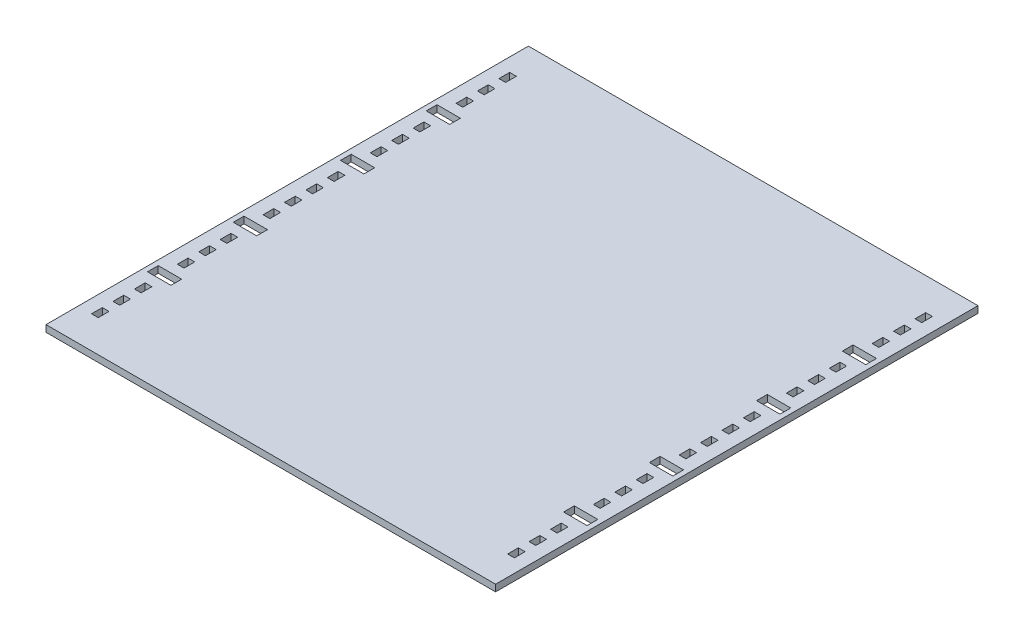
from build123d import *

# Parameters (mm, degrees)
SKETCH2_W           = 3.175
SKETCH2_H           = 5.08
SKETCH2_W_2         = 11.1125
BOSS_EXTRUDE1_DEPTH = 3.175


with BuildPart() as part:
    # Sketch2 → Boss-Extrude1 (new body)
    with BuildSketch(Plane(origin=(0, 0, 0), x_dir=(1, 0, 0), z_dir=(0, 1, 0))):
        Polygon((-61.882132175, -180.324220965), (151.160367825, -180.324220965), (151.160367825, -134.604220965), (151.160367825, -129.524220965), (151.160367825, -93.964220965), (151.160367825, -88.884220965), (151.160367825, -43.164220965), (151.160367825, -38.084220965), (151.160367825, -2.524220965), (151.160367825, 2.555779035), (151.160367825, 48.275779035), (-61.882132175, 48.275779035), (-61.882132175, 2.555779035), (-61.882132175, -2.524220965), (-61.882132175, -38.084220965), (-61.882132175, -43.164220965), (-61.882132175, -93.964220965), (-61.882132175, -129.524220965), (-61.882132175, -134.604220965), align=None)
        with Locations((-53.944632175, -162.544220965)):
            Rectangle(SKETCH2_W, SKETCH2_H, mode=Mode.SUBTRACT)
        with Locations((143.222867825, -162.544220965)):
            Rectangle(SKETCH2_W, SKETCH2_H, mode=Mode.SUBTRACT)
        with Locations((-53.944632175, -152.384220965)):
            Rectangle(SKETCH2_W, SKETCH2_H, mode=Mode.SUBTRACT)
        with Locations((-53.944632175, -142.224220965)):
            Rectangle(SKETCH2_W, SKETCH2_H, mode=Mode.SUBTRACT)
        with Locations((-53.944632175, -121.904220965)):
            Rectangle(SKETCH2_W, SKETCH2_H, mode=Mode.SUBTRACT)
        with Locations((-53.944632175, -111.744220965)):
            Rectangle(SKETCH2_W, SKETCH2_H, mode=Mode.SUBTRACT)
        with Locations((-53.944632175, -101.584220965)):
            Rectangle(SKETCH2_W, SKETCH2_H, mode=Mode.SUBTRACT)
        with Locations((-53.944632175, -81.264220965)):
            Rectangle(SKETCH2_W, SKETCH2_H, mode=Mode.SUBTRACT)
        with Locations((-53.944632175, -71.104220965)):
            Rectangle(SKETCH2_W, SKETCH2_H, mode=Mode.SUBTRACT)
        with Locations((-53.944632175, -60.944220965)):
            Rectangle(SKETCH2_W, SKETCH2_H, mode=Mode.SUBTRACT)
        with Locations((-53.944632175, -50.784220965)):
            Rectangle(SKETCH2_W, SKETCH2_H, mode=Mode.SUBTRACT)
        with Locations((-53.944632175, -30.464220965)):
            Rectangle(SKETCH2_W, SKETCH2_H, mode=Mode.SUBTRACT)
        with Locations((-53.944632175, -20.304220965)):
            Rectangle(SKETCH2_W, SKETCH2_H, mode=Mode.SUBTRACT)
        with Locations((-53.944632175, -10.144220965)):
            Rectangle(SKETCH2_W, SKETCH2_H, mode=Mode.SUBTRACT)
        with Locations((-53.944632175, 10.175779035)):
            Rectangle(SKETCH2_W, SKETCH2_H, mode=Mode.SUBTRACT)
        with Locations((-53.944632175, 20.335779035)):
            Rectangle(SKETCH2_W, SKETCH2_H, mode=Mode.SUBTRACT)
        with Locations((-53.944632175, 30.495779035)):
            Rectangle(SKETCH2_W, SKETCH2_H, mode=Mode.SUBTRACT)
        with Locations((143.222867825, 30.495779035)):
            Rectangle(SKETCH2_W, SKETCH2_H, mode=Mode.SUBTRACT)
        with Locations((143.222867825, 20.335779035)):
            Rectangle(SKETCH2_W, SKETCH2_H, mode=Mode.SUBTRACT)
        with Locations((143.222867825, 10.175779035)):
            Rectangle(SKETCH2_W, SKETCH2_H, mode=Mode.SUBTRACT)
        with Locations((143.222867825, 0.015779035)):
            Rectangle(SKETCH2_W_2, SKETCH2_H, mode=Mode.SUBTRACT)
        with Locations((143.222867825, -10.144220965)):
            Rectangle(SKETCH2_W, SKETCH2_H, mode=Mode.SUBTRACT)
        with Locations((143.222867825, -20.304220965)):
            Rectangle(SKETCH2_W, SKETCH2_H, mode=Mode.SUBTRACT)
        with Locations((143.222867825, -30.464220965)):
            Rectangle(SKETCH2_W, SKETCH2_H, mode=Mode.SUBTRACT)
        with Locations((143.222867825, -40.624220965)):
            Rectangle(SKETCH2_W_2, SKETCH2_H, mode=Mode.SUBTRACT)
        with Locations((143.222867825, -91.424220965)):
            Rectangle(SKETCH2_W_2, SKETCH2_H, mode=Mode.SUBTRACT)
        with Locations((143.222867825, -132.064220965)):
            Rectangle(SKETCH2_W_2, SKETCH2_H, mode=Mode.SUBTRACT)
        with Locations((143.222867825, -50.784220965)):
            Rectangle(SKETCH2_W, SKETCH2_H, mode=Mode.SUBTRACT)
        with Locations((143.222867825, -60.944220965)):
            Rectangle(SKETCH2_W, SKETCH2_H, mode=Mode.SUBTRACT)
        with Locations((143.222867825, -71.104220965)):
            Rectangle(SKETCH2_W, SKETCH2_H, mode=Mode.SUBTRACT)
        with Locations((143.222867825, -81.264220965)):
            Rectangle(SKETCH2_W, SKETCH2_H, mode=Mode.SUBTRACT)
        with Locations((-53.944632175, -132.064220965)):
            Rectangle(SKETCH2_W_2, SKETCH2_H, mode=Mode.SUBTRACT)
        with Locations((-53.944632175, -91.424220965)):
            Rectangle(SKETCH2_W_2, SKETCH2_H, mode=Mode.SUBTRACT)
        with Locations((143.222867825, -101.584220965)):
            Rectangle(SKETCH2_W, SKETCH2_H, mode=Mode.SUBTRACT)
        with Locations((143.222867825, -111.744220965)):
            Rectangle(SKETCH2_W, SKETCH2_H, mode=Mode.SUBTRACT)
        with Locations((143.222867825, -121.904220965)):
            Rectangle(SKETCH2_W, SKETCH2_H, mode=Mode.SUBTRACT)
        with Locations((-53.944632175, -40.624220965)):
            Rectangle(SKETCH2_W_2, SKETCH2_H, mode=Mode.SUBTRACT)
        Polygon((-59.500882175, 2.555779035), (-59.500882175, -2.524220965), (-48.388382175, -2.524220965), (-48.388382175, 2.555779035), (-52.357132175, 2.555779035), (-55.532132175, 2.555779035), align=None, mode=Mode.SUBTRACT)
        with Locations((143.222867825, -142.224220965)):
            Rectangle(SKETCH2_W, SKETCH2_H, mode=Mode.SUBTRACT)
        with Locations((143.222867825, -152.384220965)):
            Rectangle(SKETCH2_W, SKETCH2_H, mode=Mode.SUBTRACT)
    extrude(amount=BOSS_EXTRUDE1_DEPTH)


solid = part.part
